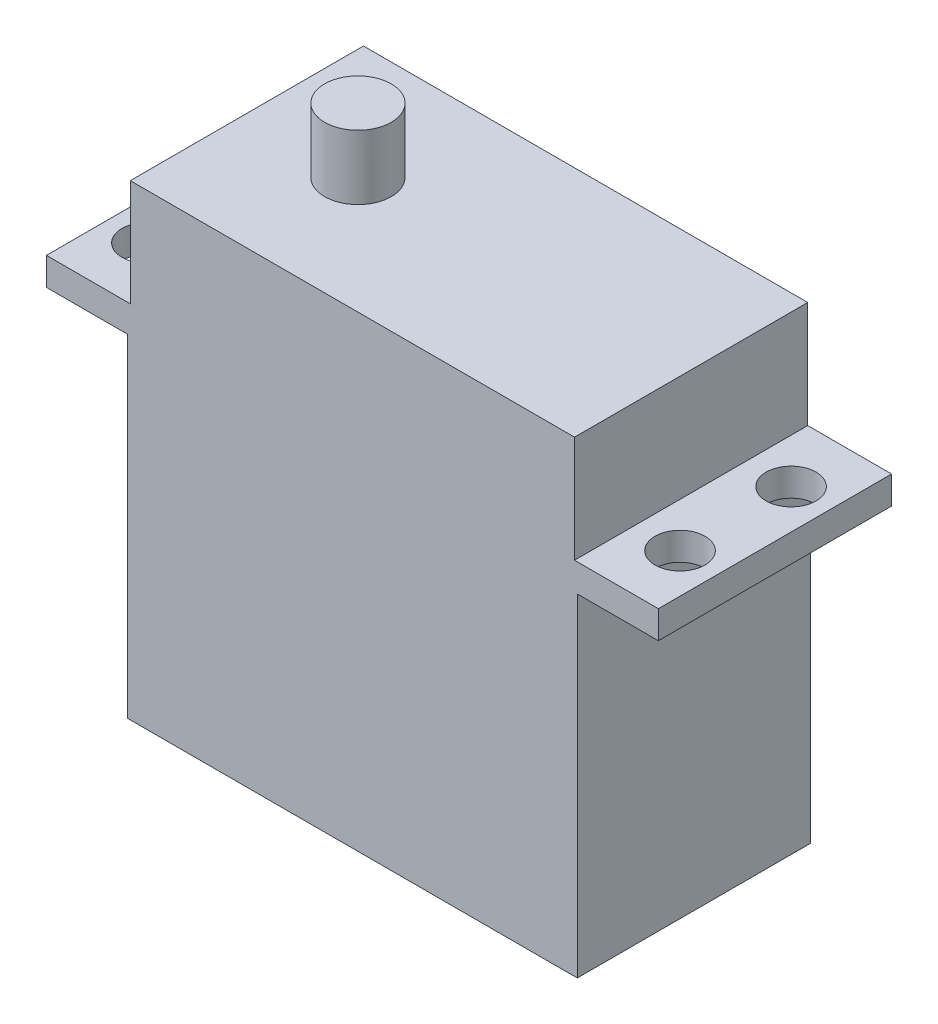
from build123d import *

# Parameters (mm, degrees)
SKETCH_1_W      = 40.5
SKETCH_1_H      = 21
EXTRUDE_1_DEPTH = 32.45
SKETCH_2_W      = 7.3
SKETCH_2_H      = 21
SKETCH_2_R      = 2.25
EXTRUDE_2_DEPTH = 2.5
SKETCH_3_W      = 40
SKETCH_3_H      = 21
EXTRUDE_3_DEPTH = 9.6
SKETCH_4_R      = 3
EXTRUDE_4_DEPTH = 5.8


with BuildPart() as part:
    # 草图1 → 凸台-拉伸1 (new body)
    with BuildSketch(Plane(origin=(0, 0, 0), x_dir=(1, 0, 0), z_dir=(0, 1, 0))):
        Rectangle(SKETCH_1_W, SKETCH_1_H)
    extrude(amount=EXTRUDE_1_DEPTH)

    # 草图2 → 凸台-拉伸2 (add)
    # profile 1 of 2: a face of its own
    with BuildSketch(Plane(origin=(0, 32.45, 0), x_dir=(1, 0, 0), z_dir=(0, 1, 0))):
        with Locations((23.9, 0)):
            Rectangle(SKETCH_2_W, SKETCH_2_H)
        with Locations(Location((24, 5, 0), (0, 0, 270))):
            Circle(SKETCH_2_R, mode=Mode.SUBTRACT)
        with Locations(Location((24, -5, 0), (0, 0, 90))):
            Circle(SKETCH_2_R, mode=Mode.SUBTRACT)
    # profile 2 of 2: a face of its own
    with BuildSketch(Plane(origin=(0, 32.45, 0), x_dir=(1, 0, 0), z_dir=(0, 1, 0))):
        with Locations((-23.9, 0)):
            Rectangle(SKETCH_2_W, SKETCH_2_H)
        with Locations(Location((-24, -5, 0), (0, 0, 270))):
            Circle(SKETCH_2_R, mode=Mode.SUBTRACT)
        with Locations(Location((-24, 5, 0), (0, 0, 90))):
            Circle(SKETCH_2_R, mode=Mode.SUBTRACT)
    extrude(amount=-EXTRUDE_2_DEPTH)

    # 草图3 → 凸台-拉伸3 (add)
    with BuildSketch(Plane(origin=(0, 32.45, 0), x_dir=(1, 0, 0), z_dir=(0, 1, 0))):
        Rectangle(SKETCH_3_W, SKETCH_3_H)
    extrude(amount=EXTRUDE_3_DEPTH)

    # 草图4 → 凸台-拉伸4 (add)
    with BuildSketch(Plane(origin=(0, 42.05, 0), x_dir=(1, 0, 0), z_dir=(0, 1, 0))):
        with Locations(Location((-10, 0, 0), (0, 0, 90))):
            Circle(SKETCH_4_R)
    extrude(amount=EXTRUDE_4_DEPTH)


solid = part.part
